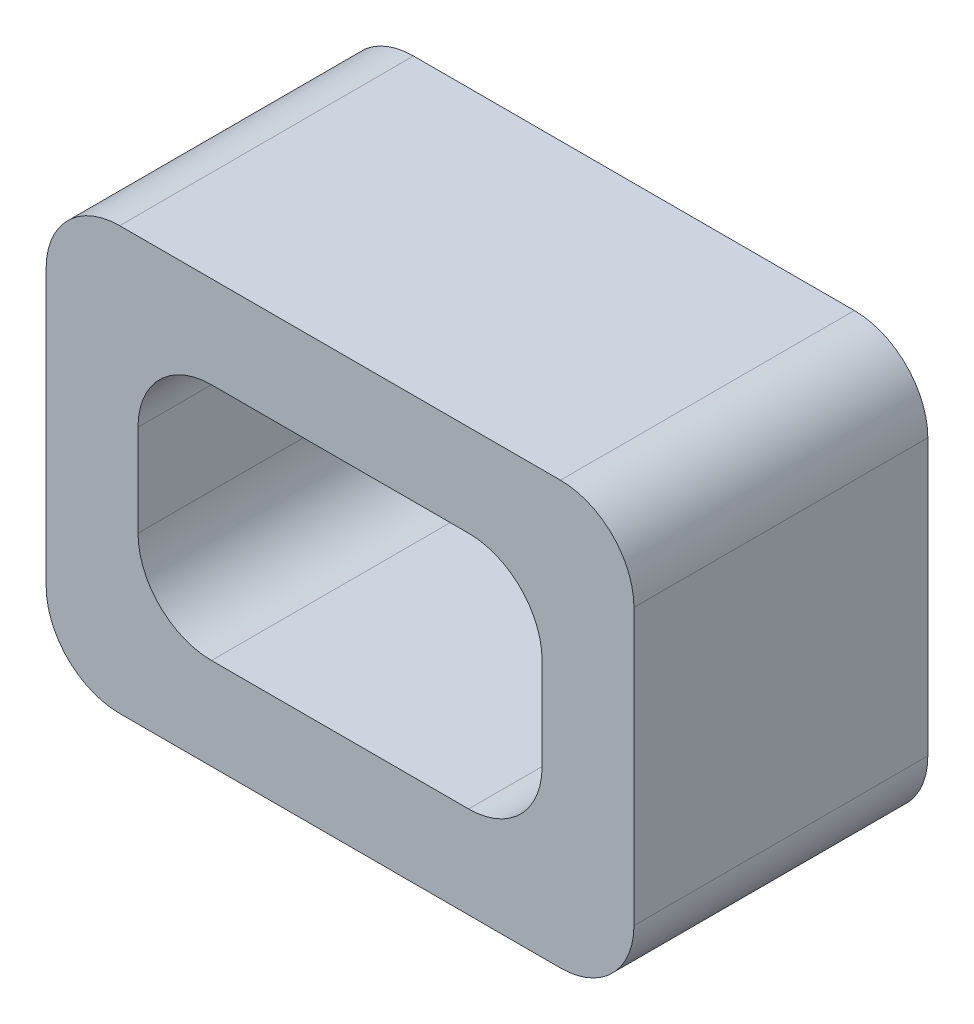
from build123d import *

# Parameters (mm, degrees)
SKETCH1_W           = 1.6
SKETCH1_H           = 1.15
BOSS_EXTRUDE1_DEPTH = 0.8
FILLET1_R           = 0.2
SKETCH2_W           = 1.1
SKETCH2_H           = 0.65
CUT_EXTRUDE1_DEPTH  = 0.8
FILLET2_R           = 0.2


with BuildPart() as part:
    # Sketch1 → Boss-Extrude1 (new body)
    with BuildSketch(Plane.XY):
        with Locations((-0.8, 0.575)):
            Rectangle(SKETCH1_W, SKETCH1_H)
    extrude(amount=BOSS_EXTRUDE1_DEPTH)

    # Fillet1
    fillet1_edges = [part.edges().sort_by_distance(p)[0] for p in [
        (0, 0, 0.4),
        (-1.6, 0, 0.4),
        (-1.6, 1.15, 0.4),
        (0, 1.15, 0.4),
    ]]
    fillet(fillet1_edges, radius=FILLET1_R)

    # Sketch2 → Cut-Extrude1 (cut)
    with BuildSketch(Plane.XY.offset(0.8)):
        with Locations((-0.8, 0.575)):
            Rectangle(SKETCH2_W, SKETCH2_H)
    extrude(amount=-CUT_EXTRUDE1_DEPTH, mode=Mode.SUBTRACT)

    # Fillet2
    fillet2_edges = [part.edges().sort_by_distance(p)[0] for p in [
        (-1.35, 0.25, 0.4),
        (-1.35, 0.9, 0.4),
        (-0.25, 0.9, 0.4),
        (-0.25, 0.25, 0.4),
    ]]
    fillet(fillet2_edges, radius=FILLET2_R)


solid = part.part
